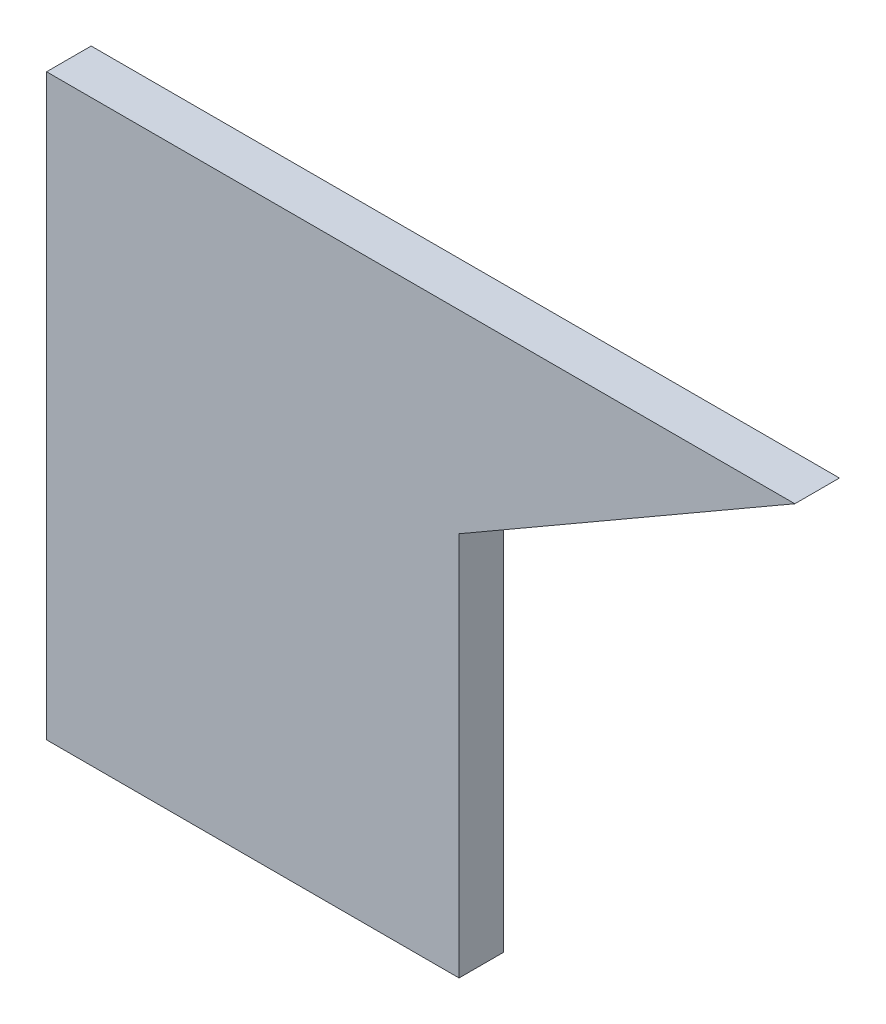
from build123d import *

# Parameters (mm, degrees)
BOSS_EXTRUDE1_DEPTH = 6.35


with BuildPart() as part:
    # Sketch1 → Boss-Extrude1 (new, symmetric)
    with BuildSketch(Plane.XY):
        Polygon((58.7375, 27.177580907), (154.370380142, 82.39125), (-58.7375, 82.39125), (-58.7375, -82.39125), (58.7375, -82.39125), align=None)
    extrude(amount=BOSS_EXTRUDE1_DEPTH, both=True)


solid = part.part
